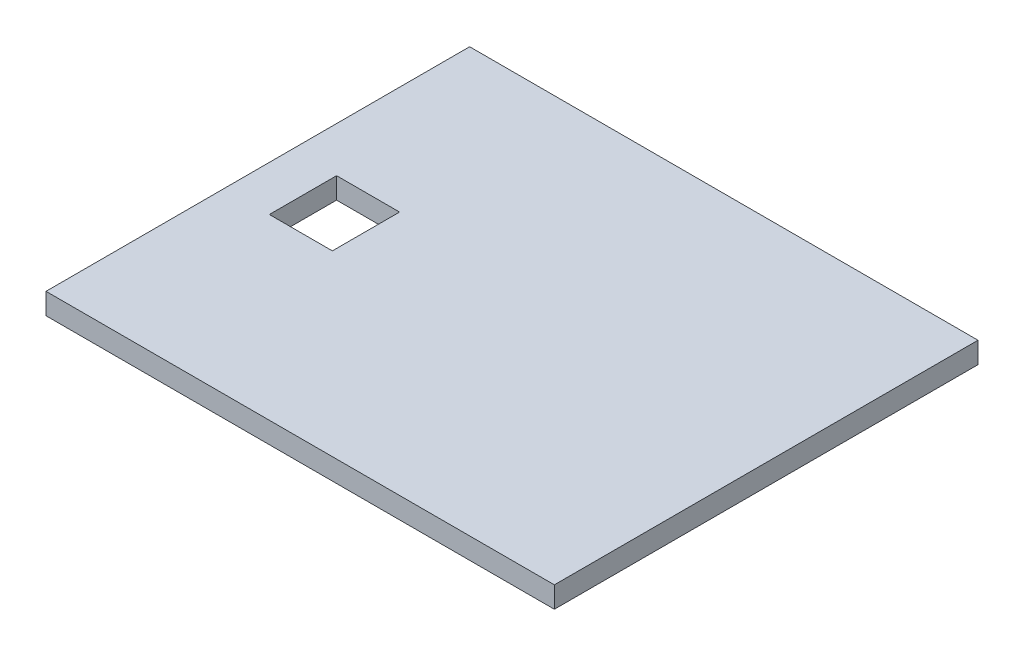
from build123d import *

# Parameters (mm, degrees)
SKETCH1_W           = 152.4
SKETCH1_H           = 127
SKETCH1_W_2         = 18.886547239
SKETCH1_H_2         = 20.152480898
BOSS_EXTRUDE1_DEPTH = 6.35


with BuildPart() as part:
    # Sketch1 → Boss-Extrude1 (new body)
    with BuildSketch(Plane(origin=(0, 0, 0), x_dir=(1, 0, 0), z_dir=(0, 1, 0))):
        Rectangle(SKETCH1_W, SKETCH1_H)
        with Locations((-53.221463144, 0)):
            Rectangle(SKETCH1_W_2, SKETCH1_H_2, mode=Mode.SUBTRACT)
    extrude(amount=BOSS_EXTRUDE1_DEPTH)


solid = part.part
